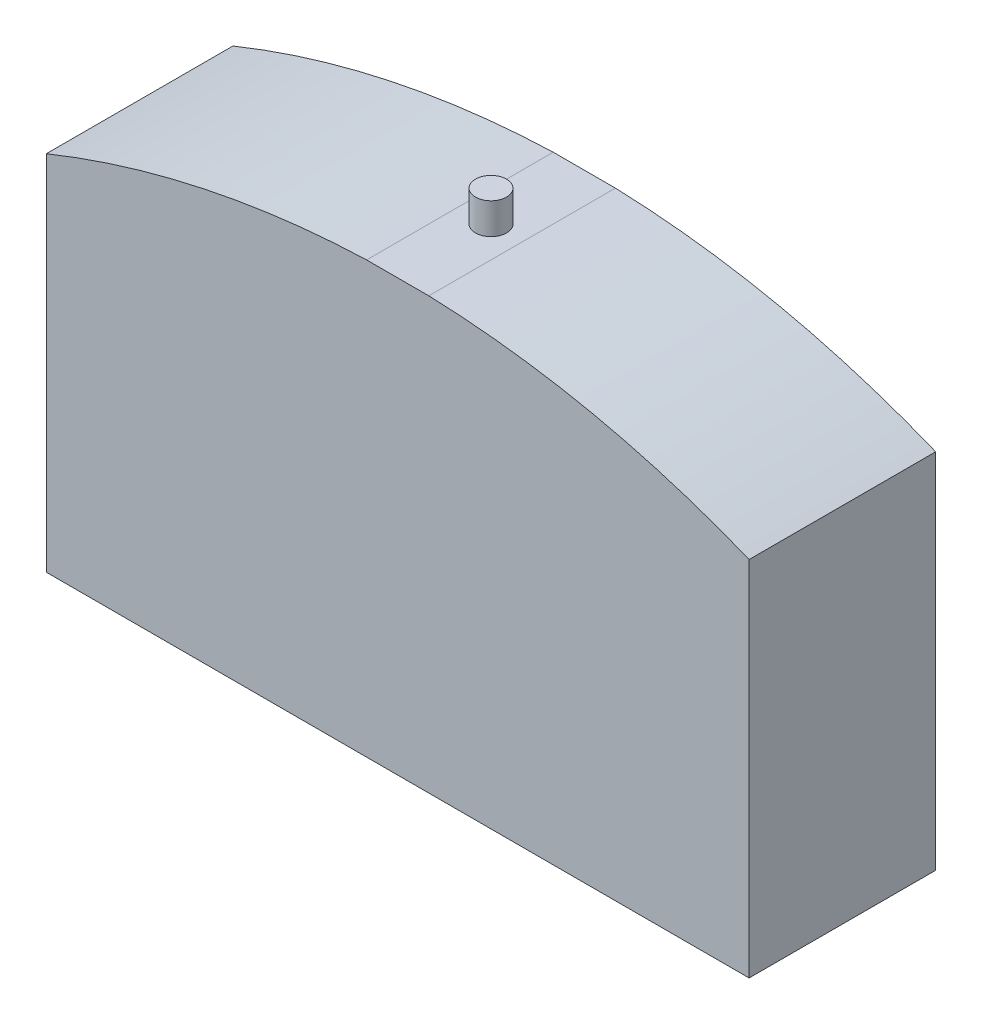
from build123d import *

# Parameters (mm, degrees)
BOSS_EXTRUDE1_DEPTH = 30
CUT_EXTRUDE1_DEPTH  = 27
SKETCH3_R           = 2.5
BOSS_EXTRUDE2_DEPTH = 5


with BuildPart() as part:
    # Sketch1 → Boss-Extrude1 (new body)
    with BuildSketch(Plane.XY):
        with BuildLine():
            Line((-5, 149.916643506), (5, 149.916643506))
            ThreePointArc((5, 149.916643506), (31.23486102, 146.711906324), (56.5, 138.952329955))
            Line((56.5, 138.952329955), (56.5, 80.682329955))
            Line((56.5, 80.682329955), (-56.5, 80.682329955))
            Line((-56.5, 80.682329955), (-56.5, 138.952329955))
            ThreePointArc((-56.5, 138.952329955), (-31.23486102, 146.711906324), (-5, 149.916643506))
        make_face()
    extrude(amount=BOSS_EXTRUDE1_DEPTH)

    # Sketch2 → Cut-Extrude1 (cut)
    with BuildSketch(Plane(origin=(0, 0, 0), x_dir=(-1, 0, 0), z_dir=(0, 0, -1))):
        with BuildLine():
            Line((4.949733431, 146.916643506), (-4.949733431, 146.916643506))
            ThreePointArc((-4.949733431, 146.916643506), (-29.649320321, 143.978879717), (-53.5, 136.91877154))
            Line((-53.5, 136.91877154), (-53.5, 83.682329955))
            Line((-53.5, 83.682329955), (53.5, 83.682329955))
            Line((53.5, 83.682329955), (53.5, 136.91877154))
            ThreePointArc((53.5, 136.91877154), (29.649320321, 143.978879717), (4.949733431, 146.916643506))
        make_face()
    extrude(amount=-CUT_EXTRUDE1_DEPTH, mode=Mode.SUBTRACT)

    # Sketch3 → Boss-Extrude2 (add)
    with BuildSketch(Plane(origin=(0, 149.916643506, 0), x_dir=(1, 0, 0), z_dir=(0, 1, 0))):
        with Locations(Location((0, -15, 0), (0, 0, 270))):
            Circle(SKETCH3_R)
    extrude(amount=BOSS_EXTRUDE2_DEPTH)


solid = part.part
